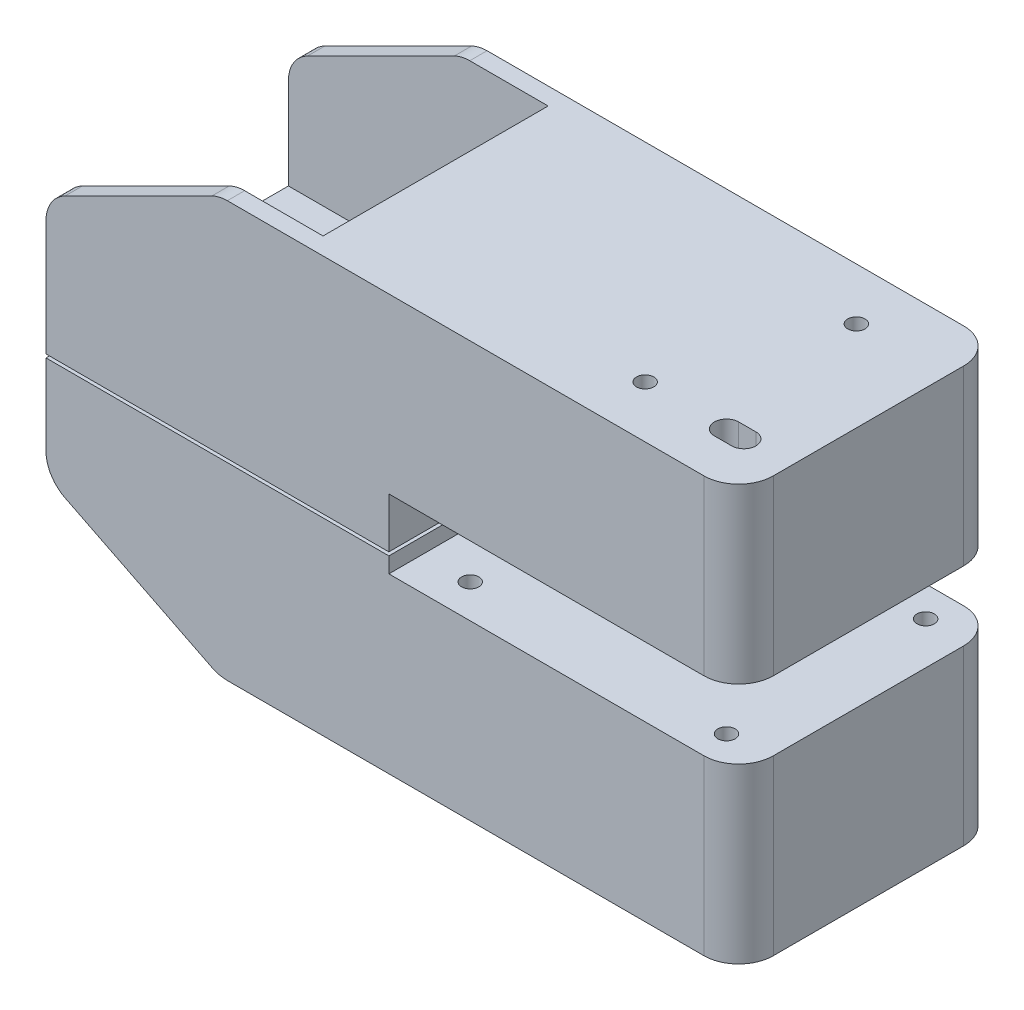
from build123d import *

# Parameters (mm, degrees)
SKETCH1_W           = 40
SKETCH1_H           = 15
SKETCH1_R           = 0.5
BOSS_EXTRUDE1_DEPTH = 3
SKETCH2_R           = 0.5
BOSS_EXTRUDE2_DEPTH = 7
BOSS_EXTRUDE3_START = 4
SKETCH3_W           = 40
SKETCH3_H           = 15
BOSS_EXTRUDE3_DEPTH = 10
SKETCH4_W           = 19.8
SKETCH4_H           = 15
BOSS_EXTRUDE4_DEPTH = 2.9
BOSS_EXTRUDE5_START = 4
SKETCH4_2_W         = 19.8
SKETCH4_2_H         = 15
BOSS_EXTRUDE5_DEPTH = 0.9
SKETCH5_W           = 15
SKETCH5_H           = 13
CUT_EXTRUDE1_DEPTH  = 4.5
CUT_EXTRUDE2_START  = -17
SKETCH5_2_W         = 15
SKETCH5_2_H         = 13
CUT_EXTRUDE2_DEPTH  = 9.5
SKETCH7_R           = 0.5
CUT_EXTRUDE3_DEPTH  = 10
CHAMFER1_SIZE       = 5
CHAMFER1_SIZE2      = 10
FILLET2_R           = 2
CHAMFER2_SIZE       = 5
CHAMFER2_SIZE2      = 10
FILLET3_R           = 2
FILLET4_R           = 2
FILLET5_R           = 2


with BuildPart() as part:
    # Sketch1 → Boss-Extrude1 (new body)
    with BuildSketch(Plane(origin=(0, 0, 0), x_dir=(1, 0, 0), z_dir=(0, 1, 0))):
        with Locations((-14.4, 0)):
            Rectangle(SKETCH1_W, SKETCH1_H)
        with Locations(Location((0.4, 4.5, 0), (0, 0, 270))):
            Circle(SKETCH1_R, mode=Mode.SUBTRACT)
        with Locations(Location((-2.8, -4.5, 0), (0, 0, 270))):
            Circle(SKETCH1_R, mode=Mode.SUBTRACT)
        with BuildLine():
            Line((1.9, -3.8), (2.9, -3.8))
            ThreePointArc((2.9, -3.8), (3.6, -4.5), (2.9, -5.2))
            Line((2.9, -5.2), (1.9, -5.2))
            ThreePointArc((1.9, -5.2), (1.2, -4.5), (1.9, -3.8))
        make_face(mode=Mode.SUBTRACT)
    extrude(amount=BOSS_EXTRUDE1_DEPTH)

    # Sketch2 → Boss-Extrude2 (add)
    with BuildSketch(Plane(origin=(0, 3, 0), x_dir=(1, 0, 0), z_dir=(0, 1, 0))):
        Polygon((-34.4, 7.5), (-34.4, 6.5), (-19.4, 6.5), (-19.4, -6.5), (-34.4, -6.5), (-34.4, -7.5), (5.6, -7.5), (5.6, 7.5), align=None)
        with Locations(Location((-2.8, -4.5, 0), (0, 0, 270))):
            Circle(SKETCH2_R, mode=Mode.SUBTRACT)
        with Locations(Location((0.4, 4.5, 0), (0, 0, 270))):
            Circle(SKETCH2_R, mode=Mode.SUBTRACT)
        with BuildLine():
            Line((2.9, -3.8), (1.9, -3.8))
            ThreePointArc((1.9, -3.8), (1.2, -4.5), (1.9, -5.2))
            Line((1.9, -5.2), (2.9, -5.2))
            ThreePointArc((2.9, -5.2), (3.6, -4.5), (2.9, -3.8))
        make_face(mode=Mode.SUBTRACT)
    extrude(amount=BOSS_EXTRUDE2_DEPTH)

    # Sketch4 → Boss-Extrude4 (add)
    with BuildSketch(Plane.XZ):
        with Locations((-24.5, 0)):
            Rectangle(SKETCH4_W, SKETCH4_H)
    extrude(amount=BOSS_EXTRUDE4_DEPTH)

    # Sketch5 → Cut-Extrude1 (cut)
    with BuildSketch(Plane(origin=(0, 3, 0), x_dir=(1, 0, 0), z_dir=(0, 1, 0))):
        with Locations((-26.9, 0)):
            Rectangle(SKETCH5_W, SKETCH5_H)
    extrude(amount=-CUT_EXTRUDE1_DEPTH, mode=Mode.SUBTRACT)

    # Chamfer1
    chamfer1_edges = [part.edges().sort_by_distance(p)[0] for p in [
        (-34.4, 10, -7),
        (-34.4, 10, 7),
    ]]
    chamfer1_side = [part.faces().sort_by_distance(p)[0] for p in [
        (-34.4, 9.802159155, 7),
    ]]
    chamfer(chamfer1_edges, length=CHAMFER1_SIZE, length2=CHAMFER1_SIZE2, reference=chamfer1_side[0])

    # Fillet2
    fillet2_edges = [part.edges().sort_by_distance(p)[0] for p in [
        (-24.4, 10, -7),
        (-24.4, 10, 7),
        (-34.4, 5, -7),
        (-34.4, 5, 7),
    ]]
    fillet(fillet2_edges, radius=FILLET2_R)

    # Fillet4
    fillet4_edges = [part.edges().sort_by_distance(p)[0] for p in [
        (5.6, 5, -7.5),
        (5.6, 5, 7.5),
    ]]
    fillet(fillet4_edges, radius=FILLET4_R)


with BuildPart() as body_2:
    # Sketch3 → Boss-Extrude3 (new body)
    with BuildSketch(Plane.XZ.offset(BOSS_EXTRUDE3_START)):
        with Locations((-14.4, 0)):
            Rectangle(SKETCH3_W, SKETCH3_H)
    extrude(amount=BOSS_EXTRUDE3_DEPTH)

    # Sketch4<2> → Boss-Extrude5 (add)
    with BuildSketch(Plane.XZ.offset(BOSS_EXTRUDE5_START)):
        with Locations((-24.5, 0)):
            Rectangle(SKETCH4_2_W, SKETCH4_2_H)
    extrude(amount=-BOSS_EXTRUDE5_DEPTH)

    # Sketch5<2> → Cut-Extrude2 (cut)
    with BuildSketch(Plane(origin=(0, 3, 0), x_dir=(1, 0, 0), z_dir=(0, 1, 0)).offset(CUT_EXTRUDE2_START)):
        with Locations((-26.9, 0)):
            Rectangle(SKETCH5_2_W, SKETCH5_2_H)
    extrude(amount=CUT_EXTRUDE2_DEPTH, mode=Mode.SUBTRACT)

    # Sketch7 → Cut-Extrude3 (cut)
    with BuildSketch(Plane(origin=(0, -4, 0), x_dir=(1, 0, 0), z_dir=(0, 1, 0))):
        with Locations(Location((3.15, 5.75, 0), (0, 0, 270))):
            Circle(SKETCH7_R)
        with Locations(Location((3.15, -5.75, 0), (0, 0, 270))):
            Circle(SKETCH7_R)
        with Locations(Location((-11.85, 5.55, 0), (0, 0, 270))):
            Circle(SKETCH7_R)
        with Locations(Location((-11.85, -5.55, 0), (0, 0, 270))):
            Circle(SKETCH7_R)
        with Locations(Location((-12.85, 0, 0), (0, 0, 270))):
            Circle(SKETCH7_R)
        with Locations(Location((-12.85, -2, 0), (0, 0, 270))):
            Circle(SKETCH7_R)
        with Locations(Location((-12.85, 2, 0), (0, 0, 270))):
            Circle(SKETCH7_R)
    extrude(amount=-CUT_EXTRUDE3_DEPTH, mode=Mode.SUBTRACT)

    # Chamfer2
    chamfer2_edges = [body_2.edges().sort_by_distance(p)[0] for p in [
        (-34.4, -14, -7),
        (-34.4, -14, 7),
    ]]
    chamfer2_side = [body_2.faces().sort_by_distance(p)[0] for p in [
        (-34.4, -8.55, -7.314578858),
    ]]
    chamfer(chamfer2_edges, length=CHAMFER2_SIZE, length2=CHAMFER2_SIZE2, reference=chamfer2_side[0])

    # Fillet3
    fillet3_edges = [body_2.edges().sort_by_distance(p)[0] for p in [
        (-24.4, -14, 7),
        (-24.4, -14, -7),
        (-34.4, -9, 7),
        (-34.4, -9, -7),
    ]]
    fillet(fillet3_edges, radius=FILLET3_R)

    # Fillet5
    fillet5_edges = [body_2.edges().sort_by_distance(p)[0] for p in [
        (5.6, -9, 7.5),
        (5.6, -9, -7.5),
    ]]
    fillet(fillet5_edges, radius=FILLET5_R)


solid = Compound([part.part, body_2.part])
